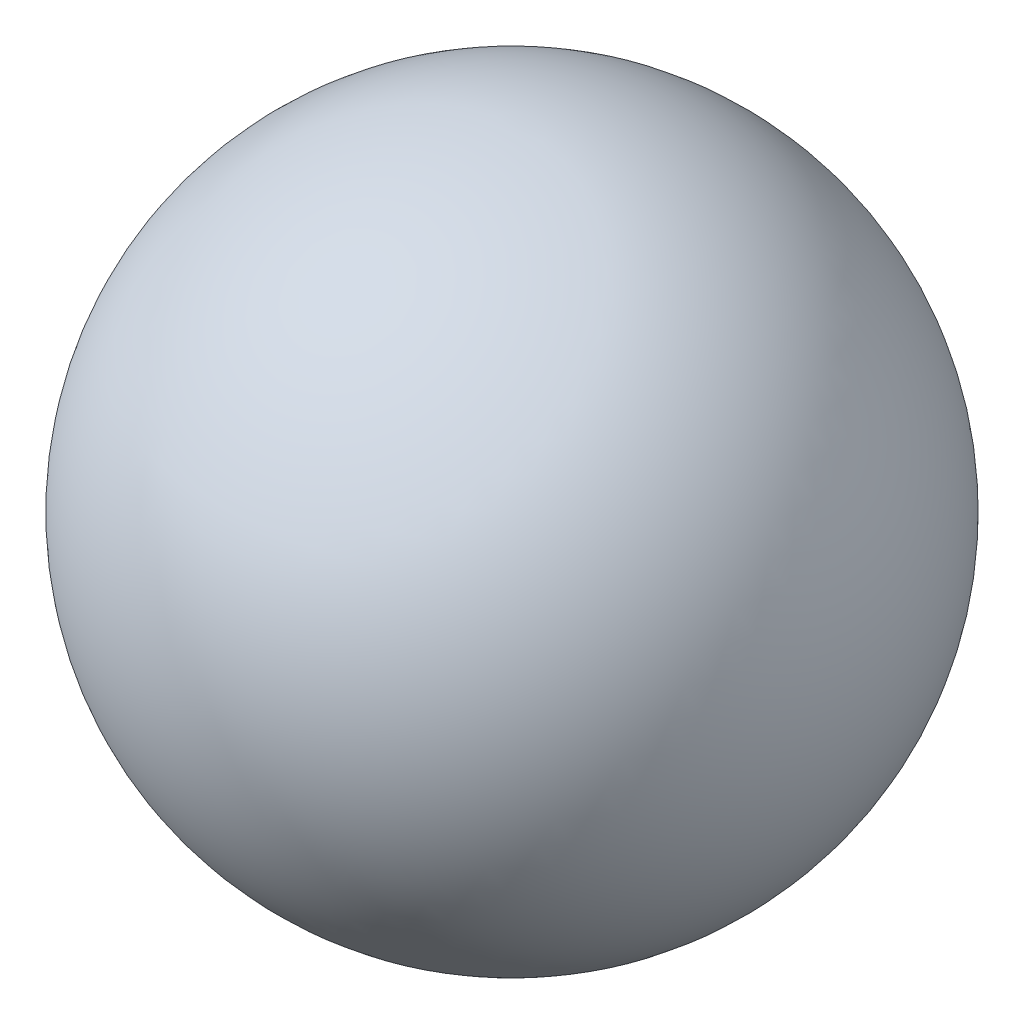
from build123d import *


with BuildPart() as part:
    # Esquisse1 → Révolution1 (revolve)
    with BuildSketch(Plane.XY):
        with BuildLine():
            Line((0, -7), (0, 7))
            ThreePointArc((0, 7), (7, 0), (0, -7))
        make_face()
    revolve(axis=Axis((0, 0, 0), (0, 1, 0)))


solid = part.part
